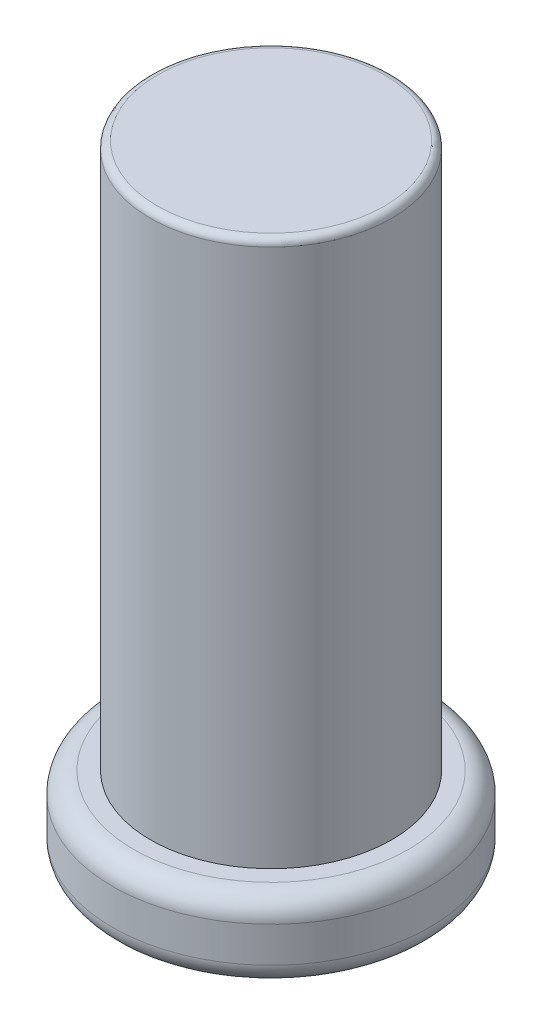
from build123d import *

# Parameters (mm, degrees)
SKETCH_1_W = 17
SKETCH_1_H = 76.85
FILLET_1_R = 3
FILLET_2_R = 1


with BuildPart() as part:
    # 草图1 → 旋转1 (revolve)
    with BuildSketch(Plane.XY):
        with Locations((-8.5, 38.425)):
            Rectangle(SKETCH_1_W, SKETCH_1_H)
        Polygon((0, -11), (0, 0), (-17, 0), (-22.35, 0), (-22.35, -11), align=None)
    revolve(axis=Axis((0, 76.85, 0), (0, -1, 0)))

    # 圆角1
    fillet_1_edges = [part.edges().sort_by_distance(p)[0] for p in [
        (22.35, -11, 0),
        (22.35, 0, 0),
    ]]
    fillet(fillet_1_edges, radius=FILLET_1_R)

    # 圆角2
    fillet_2_edges = [part.edges().sort_by_distance(p)[0] for p in [
        (17, 76.85, 0),
    ]]
    fillet(fillet_2_edges, radius=FILLET_2_R)


solid = part.part
